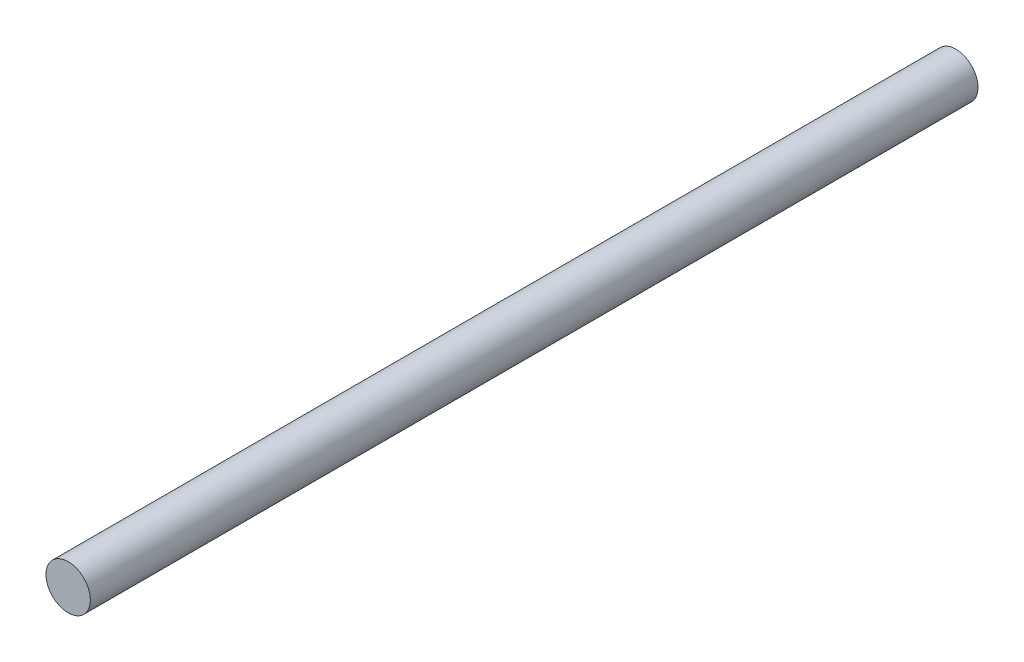
from build123d import *

# Parameters (mm, degrees)
SKETCH1_R           = 7.5
BOSS_EXTRUDE1_DEPTH = 300


with BuildPart() as part:
    # Sketch1 → Boss-Extrude1 (new body)
    with BuildSketch(Plane.XY):
        Circle(SKETCH1_R)
    extrude(amount=BOSS_EXTRUDE1_DEPTH)


solid = part.part
